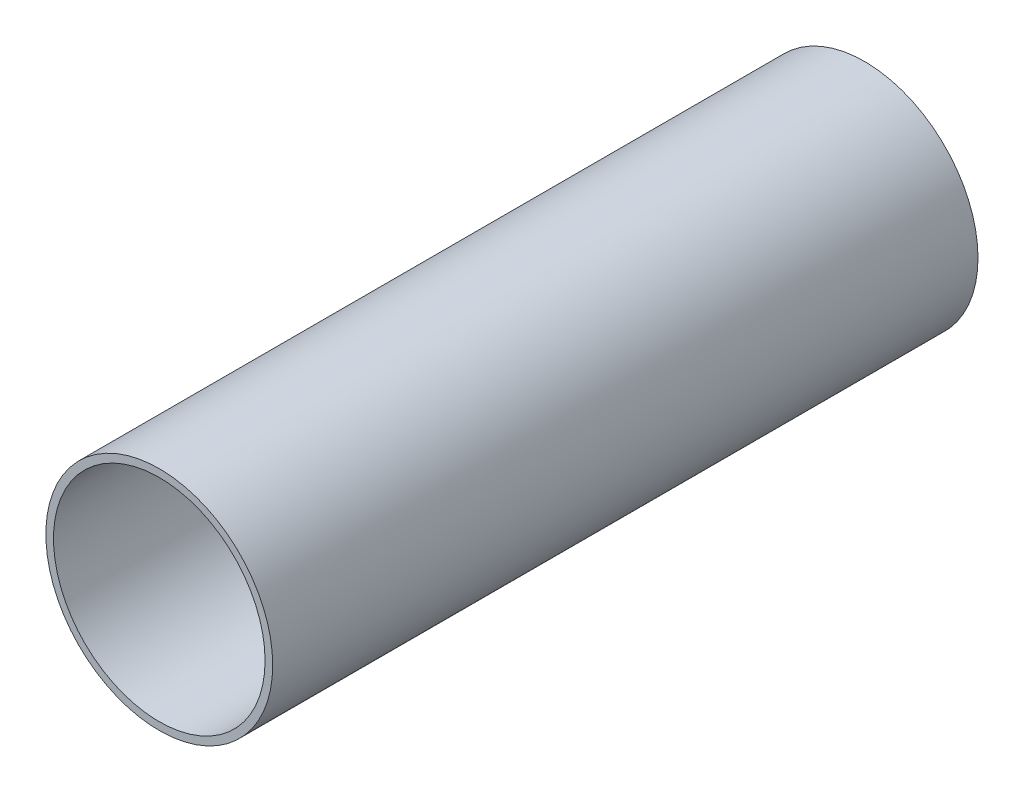
from build123d import *

# Parameters (mm, degrees)
SKETCH1_R           = 9.65
SKETCH1_R_2         = 9
BOSS_EXTRUDE1_DEPTH = 60


with BuildPart() as part:
    # Sketch1 → Boss-Extrude1 (new body)
    with BuildSketch(Plane.XY):
        Circle(SKETCH1_R)
        Circle(SKETCH1_R_2, mode=Mode.SUBTRACT)
    extrude(amount=BOSS_EXTRUDE1_DEPTH)


solid = part.part
